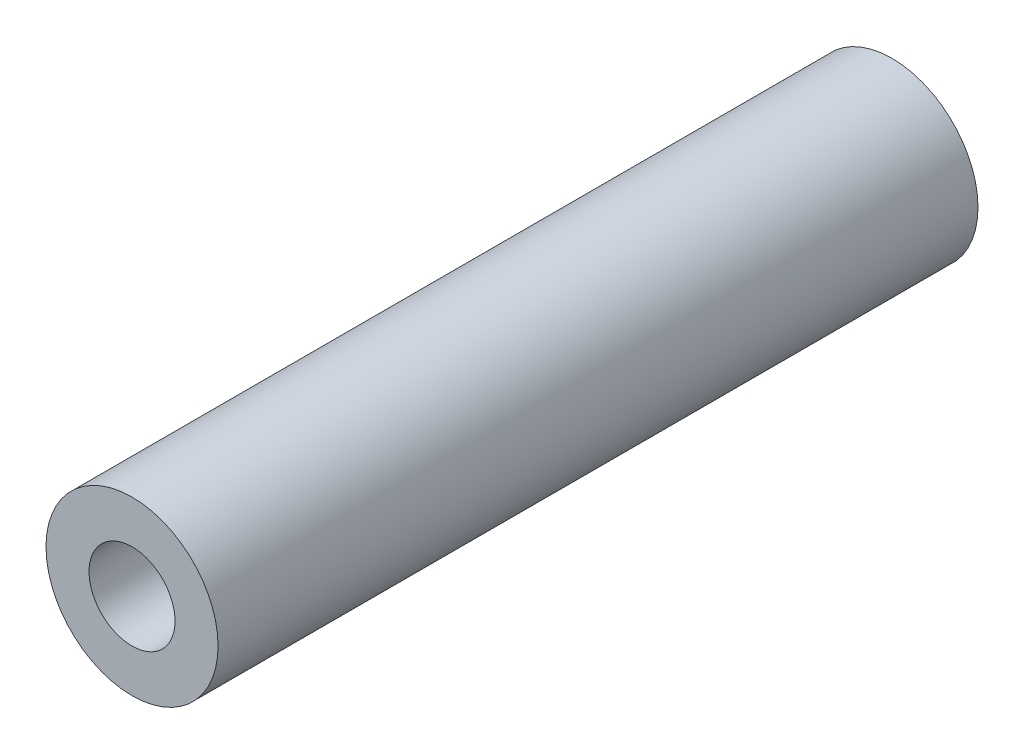
from build123d import *

# Parameters (mm, degrees)
SKETCH_1_R      = 3
SKETCH_1_R_2    = 1.5
EXTRUDE_1_DEPTH = 26.5


with BuildPart() as part:
    # 草图1 → 凸台-拉伸1 (new body)
    with BuildSketch(Plane.XY):
        Circle(SKETCH_1_R)
        Circle(SKETCH_1_R_2, mode=Mode.SUBTRACT)
    extrude(amount=EXTRUDE_1_DEPTH)


solid = part.part
